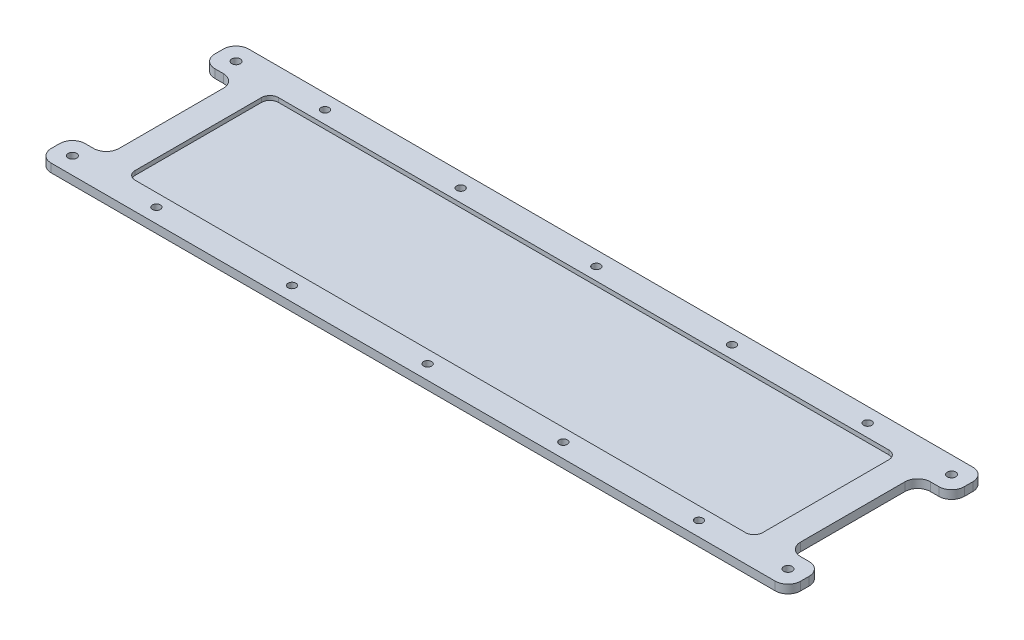
from build123d import *

# Parameters (mm, degrees)
BOSS_EXTRUDE1_DEPTH      = 1.5875
BOSS_EXTRUDE1_DEPTH_BACK = 1.5875
SKETCH1_W                = 255.27
SKETCH1_H                = 73.96988
SKETCH1_R                = 1.5
BOSS_EXTRUDE2_DEPTH      = 1.5875
BOSS_EXTRUDE2_DEPTH_BACK = 1.5875
SKETCH1_4_W              = 255.27
SKETCH1_4_H              = 73.96988
CUT_EXTRUDE1_DEPTH       = 1.5875
CUT_EXTRUDE2_DEPTH       = 3.175
CUT_EXTRUDE2_DEPTH_BACK  = 3.175
SKETCH1_6_R              = 1.5
SKETCH3_R                = 1.5875
BOSS_EXTRUDE3_DEPTH      = 3.175


with BuildPart() as part:
    # Sketch1 → Boss-Extrude1 (new, two sides: drawn at the far end of the back side and taken through both)
    with BuildSketch(Plane(origin=(0, 0, 0), x_dir=(1, 0, 0), z_dir=(0, 1, 0)).offset(-BOSS_EXTRUDE1_DEPTH_BACK)):
        with Locations((127.635, 36.98494)):
            Rectangle(SKETCH1_W, SKETCH1_H)
        with Locations((26.035, 5.3975)):
            Circle(SKETCH1_R, mode=Mode.SUBTRACT)
        with Locations((76.835, 5.3975)):
            Circle(SKETCH1_R, mode=Mode.SUBTRACT)
        with Locations((127.635, 5.3975)):
            Circle(SKETCH1_R, mode=Mode.SUBTRACT)
        with Locations((178.435, 5.3975)):
            Circle(SKETCH1_R, mode=Mode.SUBTRACT)
        with Locations((229.235, 5.3975)):
            Circle(SKETCH1_R, mode=Mode.SUBTRACT)
        with Locations((26.035, 68.57238)):
            Circle(SKETCH1_R, mode=Mode.SUBTRACT)
        with Locations((76.835, 68.57238)):
            Circle(SKETCH1_R, mode=Mode.SUBTRACT)
        with Locations((127.635, 68.57238)):
            Circle(SKETCH1_R, mode=Mode.SUBTRACT)
        with Locations((178.435, 68.57238)):
            Circle(SKETCH1_R, mode=Mode.SUBTRACT)
        with Locations((229.235, 68.57238)):
            Circle(SKETCH1_R, mode=Mode.SUBTRACT)
    extrude(amount=BOSS_EXTRUDE1_DEPTH + BOSS_EXTRUDE1_DEPTH_BACK)

    # Sketch1<4> → Boss-Extrude2 (add, two sides: drawn at the far end of the back side and taken through both)
    with BuildSketch(Plane(origin=(0, 0, 0), x_dir=(1, 0, 0), z_dir=(0, 1, 0)).offset(-BOSS_EXTRUDE2_DEPTH_BACK)):
        with Locations((127.635, 36.98494)):
            Rectangle(SKETCH1_4_W, SKETCH1_4_H)
    extrude(amount=BOSS_EXTRUDE2_DEPTH + BOSS_EXTRUDE2_DEPTH_BACK)

    # Sketch2 → Cut-Extrude1 (cut)
    with BuildSketch(Plane(origin=(0, 1.5875, 0), x_dir=(1, 0, 0), z_dir=(0, 1, 0))):
        with BuildLine():
            Line((13.335, 63.80988), (241.935, 63.80988))
            ThreePointArc((241.935, 63.80988), (244.18006403, 62.87994403), (245.11, 60.63488))
            Line((245.11, 60.63488), (245.11, 13.335))
            ThreePointArc((245.11, 13.335), (244.18006403, 11.08993597), (241.935, 10.16))
            Line((241.935, 10.16), (13.335, 10.16))
            ThreePointArc((13.335, 10.16), (11.08993597, 11.08993597), (10.16, 13.335))
            Line((10.16, 13.335), (10.16, 60.63488))
            ThreePointArc((10.16, 60.63488), (11.08993597, 62.87994403), (13.335, 63.80988))
        make_face()
    extrude(amount=-CUT_EXTRUDE1_DEPTH, mode=Mode.SUBTRACT)

    # Sketch1<6> → Cut-Extrude2 (cut, two sides: drawn at the far end of the back side and taken through both)
    with BuildSketch(Plane(origin=(0, 0, 0), x_dir=(1, 0, 0), z_dir=(0, 1, 0)).offset(-CUT_EXTRUDE2_DEPTH_BACK)):
        with Locations((178.435, 68.57238)):
            Circle(SKETCH1_6_R)
        with Locations((178.435, 5.3975)):
            Circle(SKETCH1_6_R)
        with Locations((229.235, 68.57238)):
            Circle(SKETCH1_6_R)
        with Locations((229.235, 5.3975)):
            Circle(SKETCH1_6_R)
        with Locations((127.635, 68.57238)):
            Circle(SKETCH1_6_R)
        with Locations((127.635, 5.3975)):
            Circle(SKETCH1_6_R)
        with Locations((26.035, 5.3975)):
            Circle(SKETCH1_6_R)
        with Locations((76.835, 5.3975)):
            Circle(SKETCH1_6_R)
        with Locations((26.035, 68.57238)):
            Circle(SKETCH1_6_R)
        with Locations((76.835, 68.57238)):
            Circle(SKETCH1_6_R)
    extrude(amount=CUT_EXTRUDE2_DEPTH + CUT_EXTRUDE2_DEPTH_BACK, mode=Mode.SUBTRACT)

    # Sketch3 → Boss-Extrude3 (add)
    # profile 1 of 4: a face of its own
    with BuildSketch(Plane.XZ.offset(1.5875)):
        with BuildLine():
            ThreePointArc((-4.7625, -12.7), (-1.394903955, -14.094903955), (0, -17.4625))
            Line((0, -17.4625), (0, 0))
            Line((0, 0), (-7.9375, 0))
            ThreePointArc((-7.9375, 0), (-11.305096045, -1.394903955), (-12.7, -4.7625))
            Line((-12.7, -4.7625), (-12.7, -7.9375))
            ThreePointArc((-12.7, -7.9375), (-11.305096045, -11.305096045), (-7.9375, -12.7))
            Line((-7.9375, -12.7), (-4.7625, -12.7))
        make_face()
        with Locations((-6.35, -6.35)):
            Circle(SKETCH3_R, mode=Mode.SUBTRACT)
    # profile 2 of 4: a face of its own
    with BuildSketch(Plane.XZ.offset(1.5875)):
        with BuildLine():
            Line((-4.7625, -61.26988), (-7.9375, -61.26988))
            ThreePointArc((-7.9375, -61.26988), (-11.305096045, -62.664783955), (-12.7, -66.03238))
            Line((-12.7, -66.03238), (-12.7, -69.20738))
            ThreePointArc((-12.7, -69.20738), (-11.305096045, -72.574976045), (-7.9375, -73.96988))
            Line((-7.9375, -73.96988), (0, -73.96988))
            Line((0, -73.96988), (0, -56.50738))
            ThreePointArc((0, -56.50738), (-1.394903955, -59.874976045), (-4.7625, -61.26988))
        make_face()
        with Locations((-6.35, -67.61988)):
            Circle(SKETCH3_R, mode=Mode.SUBTRACT)
    # profile 3 of 4: a face of its own
    with BuildSketch(Plane.XZ.offset(1.5875)):
        with BuildLine():
            ThreePointArc((260.0325, -61.26988), (256.664903955, -59.874976045), (255.27, -56.50738))
            Line((255.27, -56.50738), (255.27, -73.96988))
            Line((255.27, -73.96988), (263.2075, -73.96988))
            ThreePointArc((263.2075, -73.96988), (266.575096045, -72.574976045), (267.97, -69.20738))
            Line((267.97, -69.20738), (267.97, -66.03238))
            ThreePointArc((267.97, -66.03238), (266.575096045, -62.664783955), (263.2075, -61.26988))
            Line((263.2075, -61.26988), (260.0325, -61.26988))
        make_face()
        with Locations((261.62, -67.61988)):
            Circle(SKETCH3_R, mode=Mode.SUBTRACT)
    # profile 4 of 4: a face of its own
    with BuildSketch(Plane.XZ.offset(1.5875)):
        with BuildLine():
            Line((260.0325, -12.7), (263.2075, -12.7))
            ThreePointArc((263.2075, -12.7), (266.575096045, -11.305096045), (267.97, -7.9375))
            Line((267.97, -7.9375), (267.97, -4.7625))
            ThreePointArc((267.97, -4.7625), (266.575096045, -1.394903955), (263.2075, 0))
            Line((263.2075, 0), (255.27, 0))
            Line((255.27, 0), (255.27, -17.4625))
            ThreePointArc((255.27, -17.4625), (256.664903955, -14.094903955), (260.0325, -12.7))
        make_face()
        with Locations((261.62, -6.35)):
            Circle(SKETCH3_R, mode=Mode.SUBTRACT)
    extrude(amount=-BOSS_EXTRUDE3_DEPTH)


solid = part.part
